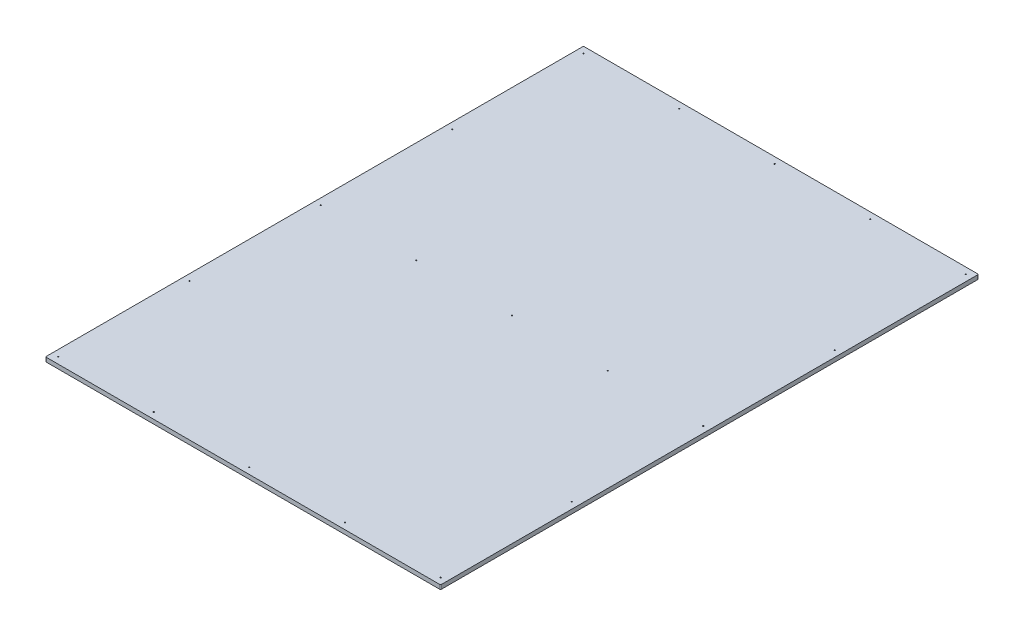
from build123d import *

# Parameters (mm, degrees)
SKETCH1_W                        = 1193.8
SKETCH1_H                        = 1625.6
BOSS_EXTRUDE1_DEPTH              = 12.7
F_1_8_0_125_DIAMETER_HOLE1_D     = 3.175
F_1_8_0_125_DIAMETER_HOLE2_D     = 3.175
F_1_8_0_125_DIAMETER_HOLE2_DEPTH = 12.7
FILLET1_R                        = 2.54


with BuildPart() as part:
    # Sketch1 → Boss-Extrude1 (new body)
    with BuildSketch(Plane(origin=(0, 0, 0), x_dir=(1, 0, 0), z_dir=(0, 1, 0))):
        Rectangle(SKETCH1_W, SKETCH1_H)
    extrude(amount=BOSS_EXTRUDE1_DEPTH)

    # 1/8 (0.125) Diameter Hole1 (through all)
    with Locations(Plane(origin=(0, 12.7, 0), x_dir=(1, 0, 0), z_dir=(0, 1, 0))):
        with Locations((577.85, 0), (-577.85, -793.75), (-577.85, 793.75), (-288.925, 793.75), (0, 793.75), (288.925, 793.75), (577.85, 793.75), (-288.925, -793.75), (0, -793.75), (288.925, -793.75), (577.85, -793.75), (-577.85, 0), (-288.925, 0), (0, 0), (288.925, 0)):
            Hole(F_1_8_0_125_DIAMETER_HOLE1_D / 2)

    # 1/8 (0.125) Diameter Hole2
    with Locations(Plane(origin=(0, 12.7, 0), x_dir=(1, 0, 0), z_dir=(0, 1, 0))):
        with Locations((577.85, 396.875), (-577.85, -396.875), (-577.85, -793.75), (577.85, -793.75), (577.85, -396.875), (-577.85, 0), (577.85, 0), (-577.85, 396.875)):
            Hole(F_1_8_0_125_DIAMETER_HOLE2_D / 2, depth=F_1_8_0_125_DIAMETER_HOLE2_DEPTH)

    # Fillet1
    fillet1_edges = [part.edges().sort_by_distance(p)[0] for p in [
        (596.9, 6.35, 812.8),
        (-596.9, 6.35, 812.8),
        (-596.9, 6.35, -812.8),
        (596.9, 6.35, -812.8),
    ]]
    fillet(fillet1_edges, radius=FILLET1_R)


solid = part.part
